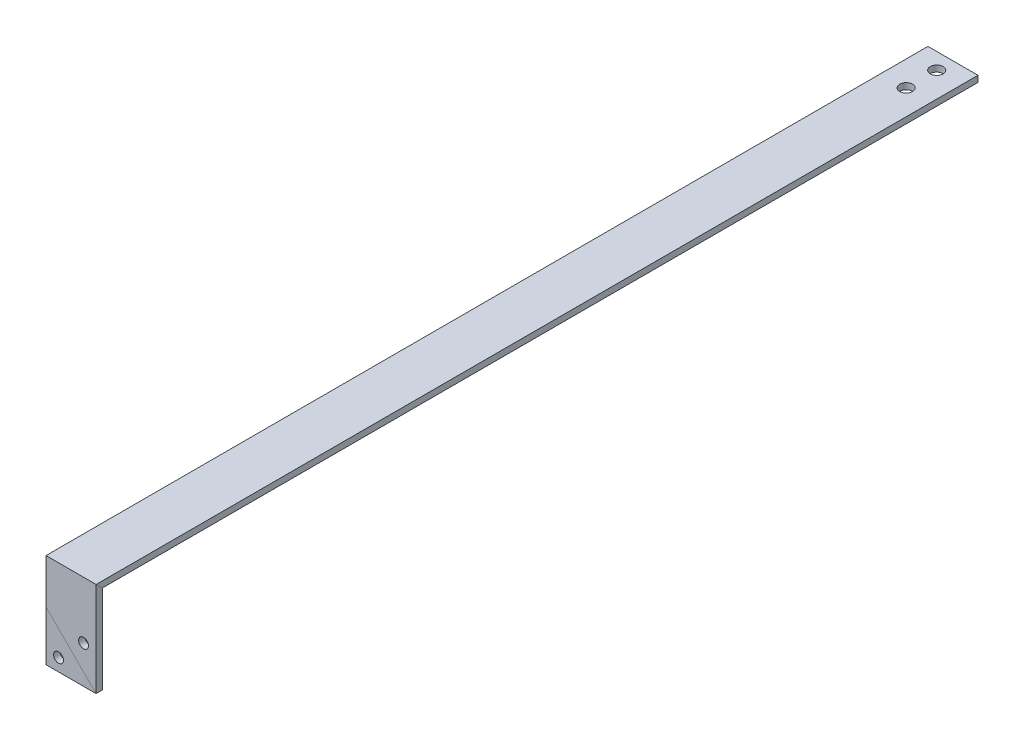
from build123d import *

# Parameters (mm, degrees)
CROQUIS1_W            = 50.8
CROQUIS1_H            = 6.31
CROQUIS2_R            = 6.5
CORTAR_EXTRUIR1_DEPTH = 10
CROQUIS5_R            = 6.5
CORTAR_EXTRUIR4_DEPTH = 10
CROQUIS7_W            = 59.2
CROQUIS7_H            = 50.8
CORTAR_EXTRUIR5_DEPTH = 6.31
CROQUIS8_R            = 5
CORTAR_EXTRUIR6_DEPTH = 10


with BuildPart() as part:
    # Barrer1: sweep along a curve in space
    with BuildLine() as barrer1_path:
        Line((0, 0, 0), (0, 0, 891.73))
        Line((0, 0, 891.73), (0, -67.38, 891.73))
        Line((0, -67.38, 891.73), (-84.6, -67.38, 891.73))
    # Croquis1 → Barrer1 (sweep)
    with BuildSketch(Plane.XY):
        Rectangle(CROQUIS1_W, CROQUIS1_H)
    sweep(path=barrer1_path.line, transition=Transition.RIGHT)

    # Croquis2 → Cortar-Extruir1 (cut)
    with BuildSketch(Plane(origin=(0, 3.155, 0), x_dir=(1, 0, 0), z_dir=(0, 1, 0))):
        with Locations(Location((0, -16.5, 0), (0, 0, 270))):
            Circle(CROQUIS2_R)
        with Locations(Location((0, -47.5, 0), (0, 0, 270))):
            Circle(CROQUIS2_R)
    extrude(amount=-CORTAR_EXTRUIR1_DEPTH, mode=Mode.SUBTRACT)

    # Croquis5 → Cortar-Extruir4 (cut)
    with BuildSketch(Plane(origin=(0, 0, 888.575), x_dir=(-1, 0, 0), z_dir=(0, 0, -1))):
        with Locations((60, -67.38)):
            Circle(CROQUIS5_R)
    extrude(amount=-CORTAR_EXTRUIR4_DEPTH, mode=Mode.SUBTRACT)

    # Croquis7 → Cortar-Extruir5 (cut)
    with BuildSketch(Plane(origin=(0, 0, 888.575), x_dir=(-1, 0, 0), z_dir=(0, 0, -1))):
        with Locations((55, -67.38)):
            Rectangle(CROQUIS7_W, CROQUIS7_H)
    extrude(amount=-CORTAR_EXTRUIR5_DEPTH, mode=Mode.SUBTRACT)

    # Croquis8 → Cortar-Extruir6 (cut)
    with BuildSketch(Plane(origin=(0, 0, 888.575), x_dir=(-1, 0, 0), z_dir=(0, 0, -1))):
        with Locations((-12.7, -54.68)):
            Circle(CROQUIS8_R)
        with Locations((12.7, -80.08)):
            Circle(CROQUIS8_R)
    extrude(amount=-CORTAR_EXTRUIR6_DEPTH, mode=Mode.SUBTRACT)


solid = part.part
